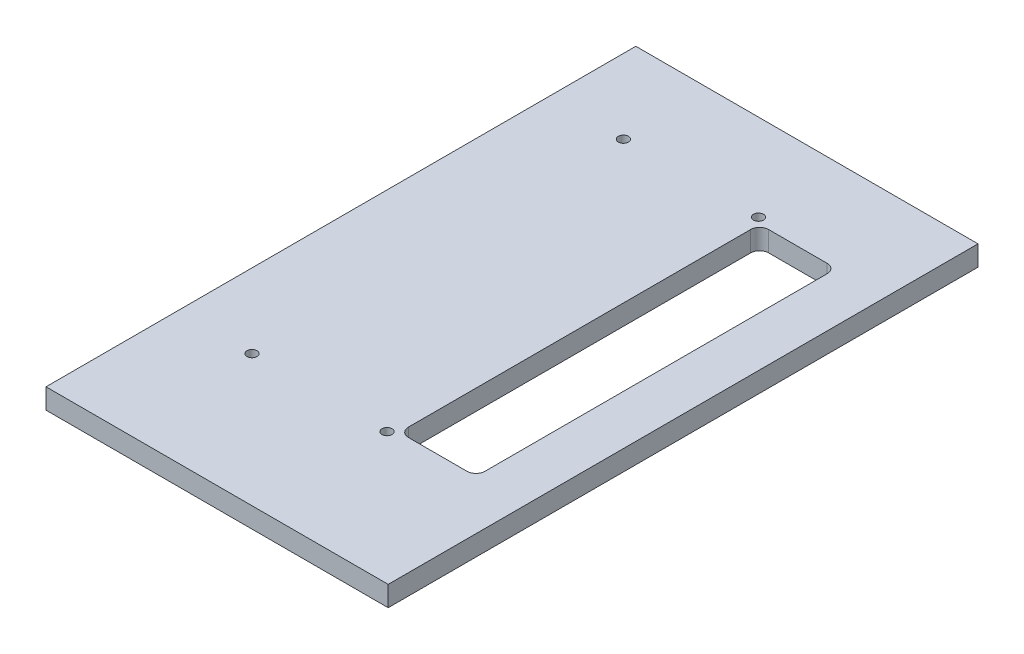
from build123d import *

# Parameters (mm, degrees)
SKETCH1_W           = 152
SKETCH1_H           = 262
BOSS_EXTRUDE1_DEPTH = 9
SKETCH2_R           = 2.25
CUT_EXTRUDE1_DEPTH  = 181.917108091


with BuildPart() as part:
    # Sketch1 → Boss-Extrude1 (new body)
    with BuildSketch(Plane(origin=(0, 0, 0), x_dir=(1, 0, 0), z_dir=(0, 1, 0))):
        with Locations((-37, -10)):
            Rectangle(SKETCH1_W, SKETCH1_H)
        with BuildLine():
            Line((13, 80), (-13, 80))
            ThreePointArc((-13, 80), (-15.828427125, 78.828427125), (-17, 76))
            Line((-17, 76), (-17, -76))
            ThreePointArc((-17, -76), (-15.828427125, -78.828427125), (-13, -80))
            Line((-13, -80), (13, -80))
            ThreePointArc((13, -80), (15.828427125, -78.828427125), (17, -76))
            Line((17, -76), (17, 76))
            ThreePointArc((17, 76), (15.828427125, 78.828427125), (13, 80))
        make_face(mode=Mode.SUBTRACT)
    extrude(amount=BOSS_EXTRUDE1_DEPTH)

    # Sketch2 → Cut-Extrude1 (cut, through all)
    with BuildSketch(Plane.XZ):
        with Locations(Location((-20, 82.5, 0), (0, 0, 270))):
            Circle(SKETCH2_R)
        with Locations(Location((-80, 82.5, 0), (0, 0, 270))):
            Circle(SKETCH2_R)
        with Locations(Location((-20, -82.5, 0), (0, 0, 270))):
            Circle(SKETCH2_R)
        with Locations(Location((-80, -82.5, 0), (0, 0, 270))):
            Circle(SKETCH2_R)
    extrude(amount=-CUT_EXTRUDE1_DEPTH, mode=Mode.SUBTRACT)

    # Cut-Extrude2 cone 1 section (through the dimple's axis) → Cut-Extrude2 (revolve, cut)
    with BuildSketch(Plane(origin=(-80, 0, 82.5), x_dir=(0, 0, -1), z_dir=(1, 0, 0))):
        Polygon((0, 0), (4.5, 0), (0, 4.5), align=None)
    revolve(axis=Axis((-80, 0, 82.5), (0, 1, 0)), mode=Mode.SUBTRACT)

    # Cut-Extrude2 cone 2 section (through the dimple's axis) → Cut-Extrude2 cone 2 (revolve, cut)
    with BuildSketch(Plane(origin=(-20, 0, 82.5), x_dir=(0, 0, -1), z_dir=(1, 0, 0))):
        Polygon((0, 0), (4.5, 0), (0, 4.5), align=None)
    revolve(axis=Axis((-20, 0, 82.5), (0, 1, 0)), mode=Mode.SUBTRACT)

    # Cut-Extrude2 cone 3 section (through the dimple's axis) → Cut-Extrude2 cone 3 (revolve, cut)
    with BuildSketch(Plane(origin=(-20, 0, -82.5), x_dir=(0, 0, -1), z_dir=(1, 0, 0))):
        Polygon((0, 0), (4.5, 0), (0, 4.5), align=None)
    revolve(axis=Axis((-20, 0, -82.5), (0, 1, 0)), mode=Mode.SUBTRACT)

    # Cut-Extrude2 cone 4 section (through the dimple's axis) → Cut-Extrude2 cone 4 (revolve, cut)
    with BuildSketch(Plane(origin=(-80, 0, -82.5), x_dir=(0, 0, -1), z_dir=(1, 0, 0))):
        Polygon((0, 0), (4.5, 0), (0, 4.5), align=None)
    revolve(axis=Axis((-80, 0, -82.5), (0, 1, 0)), mode=Mode.SUBTRACT)


solid = part.part
